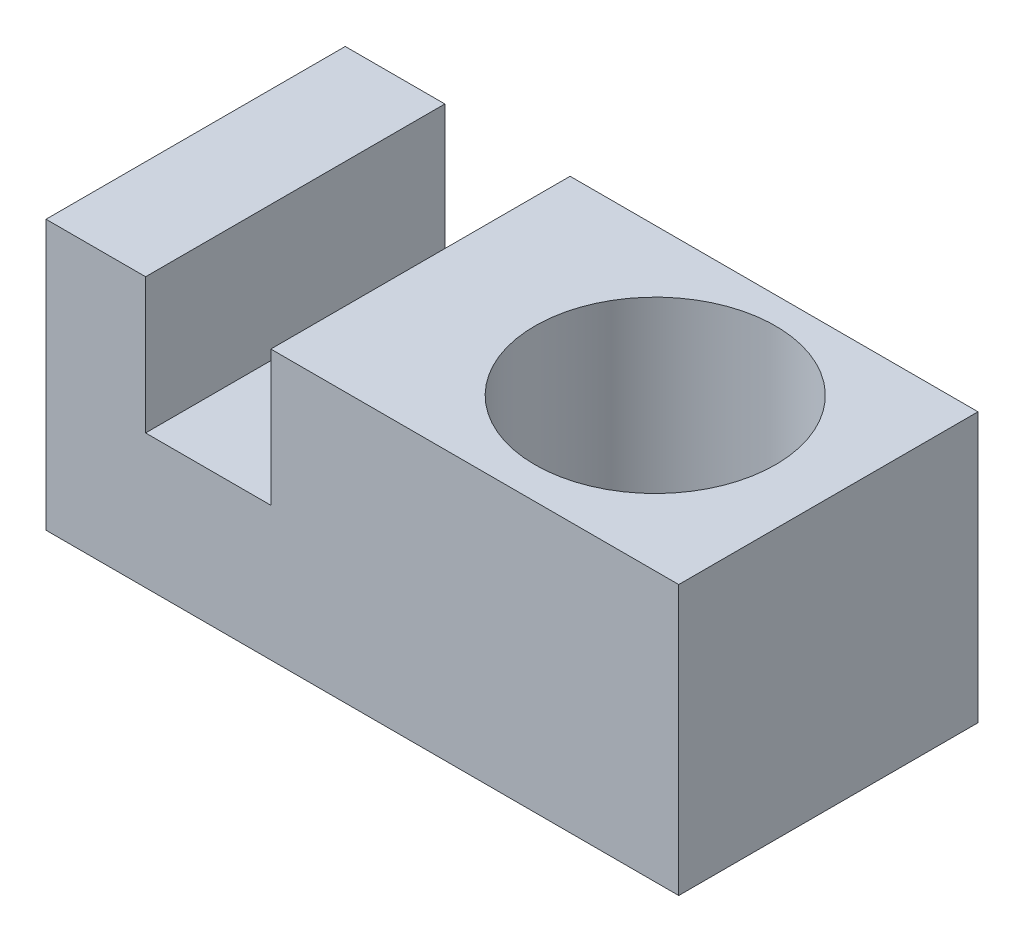
from build123d import *

# Parameters (mm, degrees)
SKETCH1_W           = 42.285714286
SKETCH1_H           = 20
BOSS_EXTRUDE1_DEPTH = 18
SKETCH2_R           = 8.03891696
CUT_EXTRUDE1_DEPTH  = 18
SKETCH4_W           = 8.368646061
SKETCH4_H           = 9.041107824
CUT_EXTRUDE2_DEPTH  = 20


with BuildPart() as part:
    # Sketch1 → Boss-Extrude1 (new body)
    with BuildSketch(Plane(origin=(0, 0, 0), x_dir=(1, 0, 0), z_dir=(0, 1, 0))):
        with Locations((21.142857143, 10)):
            Rectangle(SKETCH1_W, SKETCH1_H)
    extrude(amount=BOSS_EXTRUDE1_DEPTH)

    # Sketch2 → Cut-Extrude1 (cut)
    with BuildSketch(Plane(origin=(0, 18, 0), x_dir=(1, 0, 0), z_dir=(0, 1, 0))):
        with Locations(Location((30.549434958, 10.165764801, 0), (0, 0, 270))):
            Circle(SKETCH2_R)
    extrude(amount=-CUT_EXTRUDE1_DEPTH, mode=Mode.SUBTRACT)

    # Sketch4 → Cut-Extrude2 (cut)
    with BuildSketch(Plane.XY):
        with Locations((10.8404183, 13.479446088)):
            Rectangle(SKETCH4_W, SKETCH4_H)
    extrude(amount=-CUT_EXTRUDE2_DEPTH, mode=Mode.SUBTRACT)


solid = part.part
